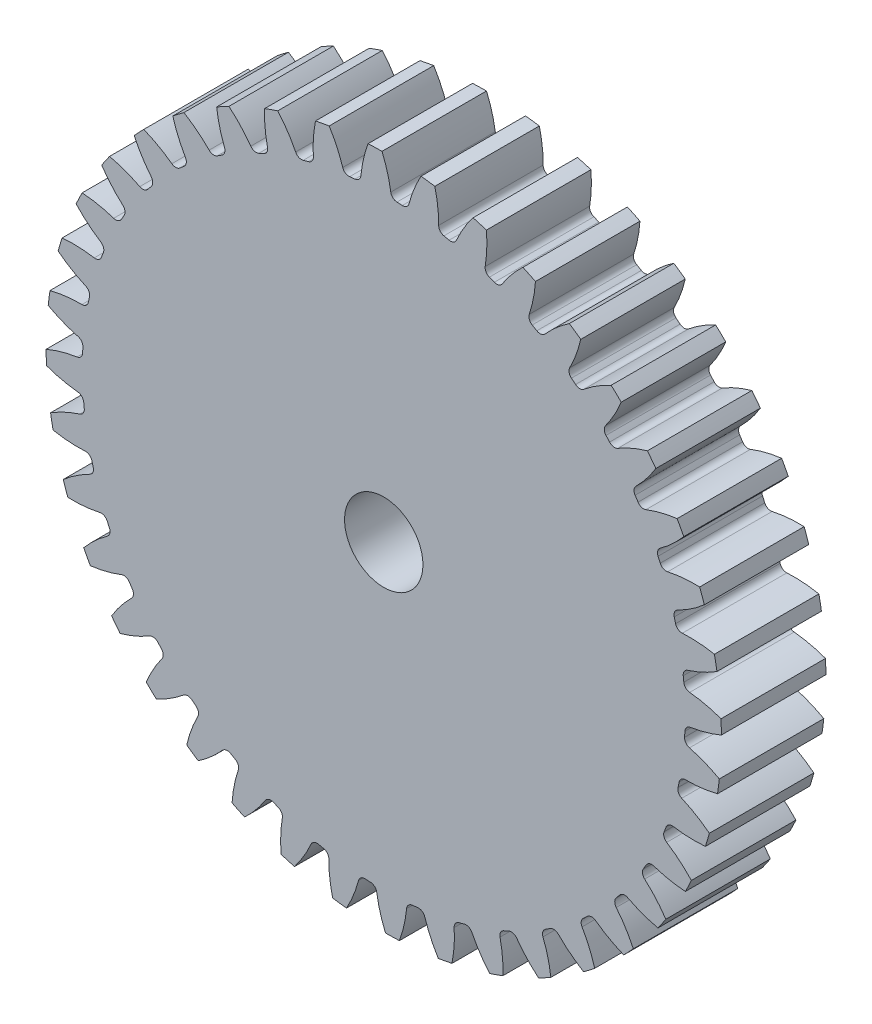
from build123d import *

# Parameters (mm, degrees)
SKETCH3_R         = 20.515384615
GEARBODY_DEPTH    = 6.35
TOOTHCUT_DEPTH    = 30.699907606
CIRPATTERN1_COUNT = 40
BOREDIA_R         = 2.38125
BORE_DEPTH        = 12700


with BuildPart() as part:
    # Sketch3 → gearBody (new body)
    with BuildSketch(Plane.XY):
        Circle(SKETCH3_R)
    extrude(amount=GEARBODY_DEPTH)

    # Sketch2 → toothCut (cut, through all)
    with BuildSketch(Plane.XY):
        with BuildLine():
            ThreePointArc((18.280615616, -1.127510186), (18.289936582, -0.964575728), (18.297805348, -0.801564684))
            ThreePointArc((18.297805348, -0.801564684), (18.399102393, -0.553747137), (18.634783106, -0.426746235))
            ThreePointArc((18.634783106, -0.426746235), (21.601606916, 0.674945397), (23.880974313, 2.870452683))
            ThreePointArc((23.880974313, 2.870452683), (24.019487914, -1.266741136), (23.446577866, -5.366415853))
            ThreePointArc((23.446577866, -5.366415853), (21.410785813, -2.943335441), (18.576299356, -1.535693974))
            ThreePointArc((18.576299356, -1.535693974), (18.355284414, -1.38460783), (18.280615616, -1.127510186))
        make_face()
    toothcut = extrude(amount=TOOTHCUT_DEPTH, mode=Mode.SUBTRACT)

    # CirPattern1: toothCut ×40 about axis
    cirpattern1_axis = Axis((0, 0, 6.35), (0, 0, -1))
    for i in range(1, CIRPATTERN1_COUNT):
        add(toothcut.rotate(cirpattern1_axis, i * 360 / CIRPATTERN1_COUNT), mode=Mode.SUBTRACT)

    # boreDia → bore (cut, symmetric)
    with BuildSketch(Plane.XY):
        Circle(BOREDIA_R)
    extrude(amount=BORE_DEPTH, both=True, mode=Mode.SUBTRACT)


solid = part.part
